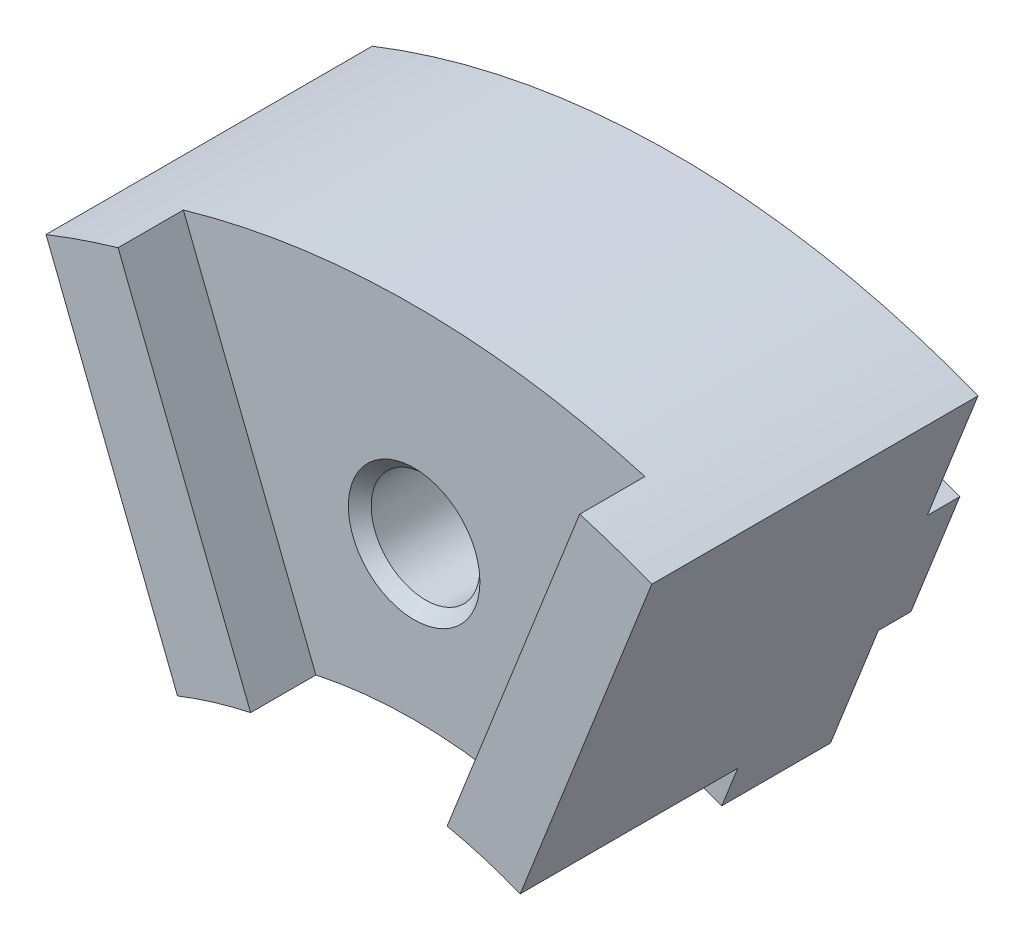
from build123d import *

# Parameters (mm, degrees)
BOSS_EXTRU_1_DEPTH          = 12
ENL_V_START                 = -7
ENL_V_MAT_EXTRU_1_DEPTH     = 7
BOSS_EXTRU_2_DEPTH          = 3
BOSS_EXTRU_3_DEPTH          = 1.5
TROU_TARAUD_M61_D           = 5
TROU_TARAUD_M61_CSINK_D     = 6.05
TROU_TARAUD_M61_CSINK_ANGLE = 90


with BuildPart() as part:
    # Esquisse2 → Boss.-Extru.1 (new body)
    with BuildSketch(Plane.XY):
        with BuildLine():
            Line((-7.146773921, 18.143142576), (-13.927046616, 35.355867583))
            ThreePointArc((-13.927046616, 35.355867583), (0, 38), (13.927046616, 35.355867583))
            Line((13.927046616, 35.355867583), (7.146773921, 18.143142576))
            ThreePointArc((7.146773921, 18.143142576), (0, 19.5), (-7.146773921, 18.143142576))
        make_face()
    extrude(amount=BOSS_EXTRU_1_DEPTH)

    # Esquisse4 → Enlèv. mat.-Extru.1 (cut)
    with BuildSketch(Plane.XY.offset(12).offset(ENL_V_START)):
        with BuildLine():
            Line((-7.879776375, 20.003977712), (-7.146773921, 18.143142576))
            ThreePointArc((-7.146773921, 18.143142576), (0, 19.5), (7.146773921, 18.143142576))
            Line((7.146773921, 18.143142576), (7.879776375, 20.003977712))
            ThreePointArc((7.879776375, 20.003977712), (0, 21.5), (-7.879776375, 20.003977712))
        make_face()
    extrude(amount=ENL_V_MAT_EXTRU_1_DEPTH, mode=Mode.SUBTRACT)

    # Esquisse5 → Boss.-Extru.2 (add)
    with BuildSketch(Plane.XY.offset(12)):
        with BuildLine():
            Line((-13.927046616, 35.355867583), (-7.879776375, 20.003977712))
            ThreePointArc((-7.879776375, 20.003977712), (-6.219766636, 20.580682763), (-4.518203594, 21.019891443))
            Line((-4.518203594, 21.019891443), (-10.611385095, 36.488333839))
            ThreePointArc((-10.611385095, 36.488333839), (-12.282274938, 35.960335404), (-13.927046616, 35.355867583))
        make_face()
        with BuildLine():
            Line((7.879776375, 20.003977712), (13.927046616, 35.355867583))
            ThreePointArc((13.927046616, 35.355867583), (12.282274938, 35.960335404), (10.611385095, 36.488333839))
            Line((10.611385095, 36.488333839), (4.518203594, 21.019891443))
            ThreePointArc((4.518203594, 21.019891443), (6.219766636, 20.580682763), (7.879776375, 20.003977712))
        make_face()
    extrude(amount=BOSS_EXTRU_2_DEPTH)

    # Esquisse6 → Boss.-Extru.3 (add)
    with BuildSketch(Plane(origin=(0, 0, 0), x_dir=(-1, 0, 0), z_dir=(0, 0, -1))):
        with BuildLine():
            Line((11.591313455, 29.42626351), (9.345781281, 23.725647984))
            ThreePointArc((9.345781281, 23.725647984), (6.716786511, 24.599487372), (4.008510327, 25.182967358))
            Line((4.008510327, 25.182967358), (6.297398832, 30.993649345))
            ThreePointArc((6.297398832, 30.993649345), (8.978623581, 30.325696206), (11.591313455, 29.42626351))
        make_face()
        with BuildLine():
            Line((-9.345781281, 23.725647984), (-11.591313455, 29.42626351))
            ThreePointArc((-11.591313455, 29.42626351), (-8.978623581, 30.325696206), (-6.297398832, 30.993649345))
            Line((-6.297398832, 30.993649345), (-4.008510327, 25.182967358))
            ThreePointArc((-4.008510327, 25.182967358), (-6.716786511, 24.599487372), (-9.345781281, 23.725647984))
        make_face()
    extrude(amount=BOSS_EXTRU_3_DEPTH)

    # Trou taraudé M61 (through all)
    with Locations(Plane.XY.offset(12)):
        with Locations((0, 28.5)):
            CounterSinkHole(TROU_TARAUD_M61_D / 2, TROU_TARAUD_M61_CSINK_D / 2, counter_sink_angle=TROU_TARAUD_M61_CSINK_ANGLE)


solid = part.part
